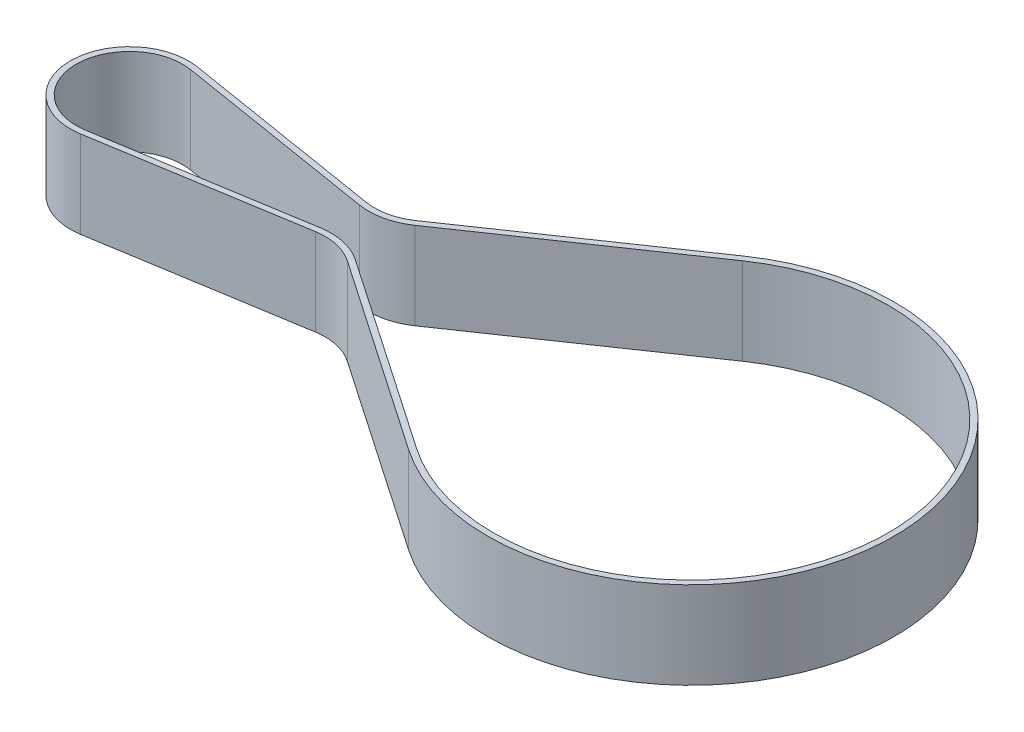
from build123d import *

# Parameters (mm, degrees)
BOSS_EXTRUDE1_DEPTH = 15


with BuildPart() as part:
    # Sketch1 → Boss-Extrude1 (new body)
    with BuildSketch(Plane(origin=(0, 0, 0), x_dir=(1, 0, 0), z_dir=(0, 1, 0))):
        with BuildLine():
            Line((13.690511277, 26.701981164), (-19.81165019, 3.772864432))
            ThreePointArc((-19.81165019, 3.772864432), (-23.19574274, 2.302737069), (-26.883808256, 2.195361114))
            Line((-26.883808256, 2.195361114), (-61.688839006, 7.856936383))
            ThreePointArc((-61.688839006, 7.856936383), (-73.491684878, -2.181126894), (-61.688839006, -12.219190171))
            Line((-61.688839006, -12.219190171), (-26.883808256, -6.557614903))
            ThreePointArc((-26.883808256, -6.557614903), (-23.19574274, -6.664990858), (-19.81165019, -8.135118221))
            Line((-19.81165019, -8.135118221), (13.690514664, -31.064237271))
            ThreePointArc((13.690514664, -31.064237271), (68.458315122, -2.181124842), (13.690511277, 26.701981164))
        make_face()
        with BuildLine():
            ThreePointArc((-61.849395377, -11.232163499), (-72.491684878, -2.181126275), (-61.849394155, 6.869909512))
            Line((-61.849394155, 6.869909512), (-27.044363406, 1.208334243))
            ThreePointArc((-27.044363406, 1.208334243), (-22.978034759, 1.326723117), (-19.246855794, 2.947632773))
            Line((-19.246855794, 2.947632773), (14.255305672, 25.876749506))
            ThreePointArc((14.255305672, 25.876749506), (67.458315122, -2.181124901), (14.255308962, -30.239005546))
            Line((14.255308962, -30.239005546), (-19.246859523, -7.309889779))
            ThreePointArc((-19.246859523, -7.309889779), (-22.978035703, -5.688981573), (-27.044361209, -5.570592498))
            Line((-27.044361209, -5.570592498), (-61.849395377, -11.232163499))
        make_face(mode=Mode.SUBTRACT)
    extrude(amount=BOSS_EXTRUDE1_DEPTH)


solid = part.part
